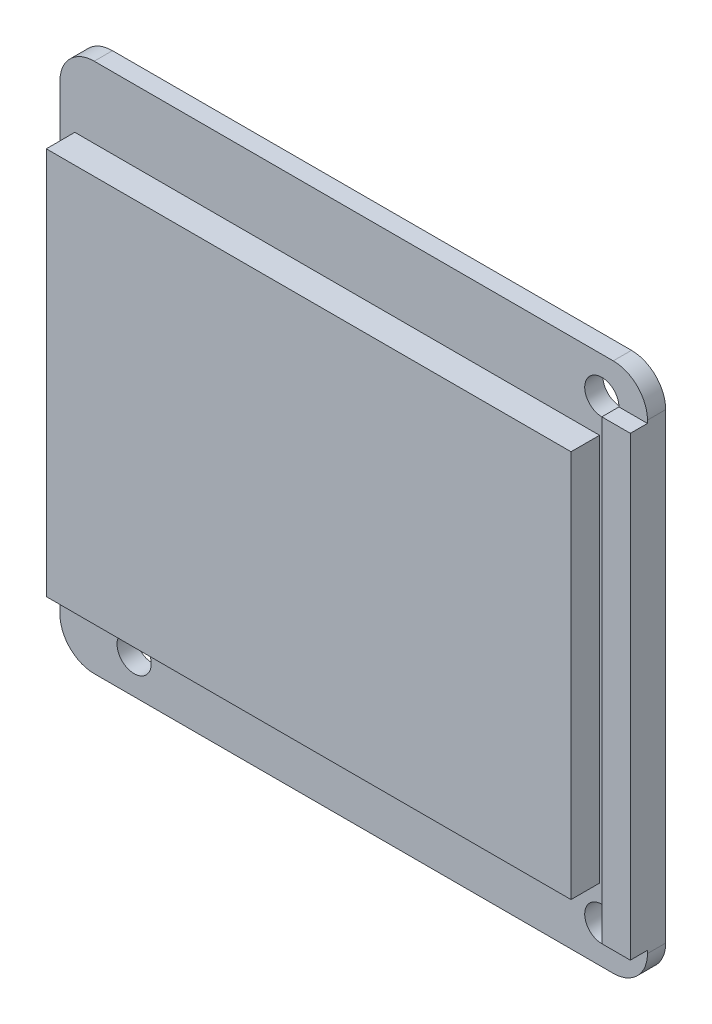
from build123d import *

# Parameters (mm, degrees)
ESQUISSE1_W             = 51.5
ESQUISSE1_H             = 46.5
BOSS_EXTRU_1_DEPTH      = 1.6
ESQUISSE2_W             = 46
ESQUISSE2_H             = 34
BOSS_EXTRU_2_DEPTH      = 2.5
ESQUISSE3_W             = 2.5
ESQUISSE3_H             = 40
BOSS_EXTRU_3_DEPTH      = 1.5
ESQUISSE4_R             = 1.5
ENL_V_MAT_EXTRU_1_DEPTH = 70.431621038
CONG_1_R                = 3


with BuildPart() as part:
    # Esquisse1 → Boss.-Extru.1 (new body)
    with BuildSketch(Plane.XY):
        with Locations((25.75, 23.25)):
            Rectangle(ESQUISSE1_W, ESQUISSE1_H)
    extrude(amount=BOSS_EXTRU_1_DEPTH)

    # Esquisse2 → Boss.-Extru.2 (add)
    with BuildSketch(Plane.XY.offset(1.6)):
        with Locations((24.3, 23.25)):
            Rectangle(ESQUISSE2_W, ESQUISSE2_H)
    extrude(amount=BOSS_EXTRU_2_DEPTH)

    # Esquisse3 → Boss.-Extru.3 (add)
    with BuildSketch(Plane.XY.offset(1.6)):
        with Locations((50.25, 23.25)):
            Rectangle(ESQUISSE3_W, ESQUISSE3_H)
    extrude(amount=BOSS_EXTRU_3_DEPTH)

    # Esquisse4 → Enlèv. mat.-Extru.1 (cut, through all)
    with BuildSketch(Plane.XY.offset(1.6)):
        with Locations((47.5, 3.25)):
            Circle(ESQUISSE4_R)
        with Locations((47.5, 43.25)):
            Circle(ESQUISSE4_R)
        with Locations((6.5, 3.25)):
            Circle(ESQUISSE4_R)
    extrude(amount=-ENL_V_MAT_EXTRU_1_DEPTH, mode=Mode.SUBTRACT)

    # Congé1
    cong_1_edges = [part.edges().sort_by_distance(p)[0] for p in [
        (0, 46.5, 0.8),
        (51.5, 46.5, 0.8),
        (51.5, 0, 0.8),
        (0, 0, 0.8),
    ]]
    fillet(cong_1_edges, radius=CONG_1_R)


solid = part.part
